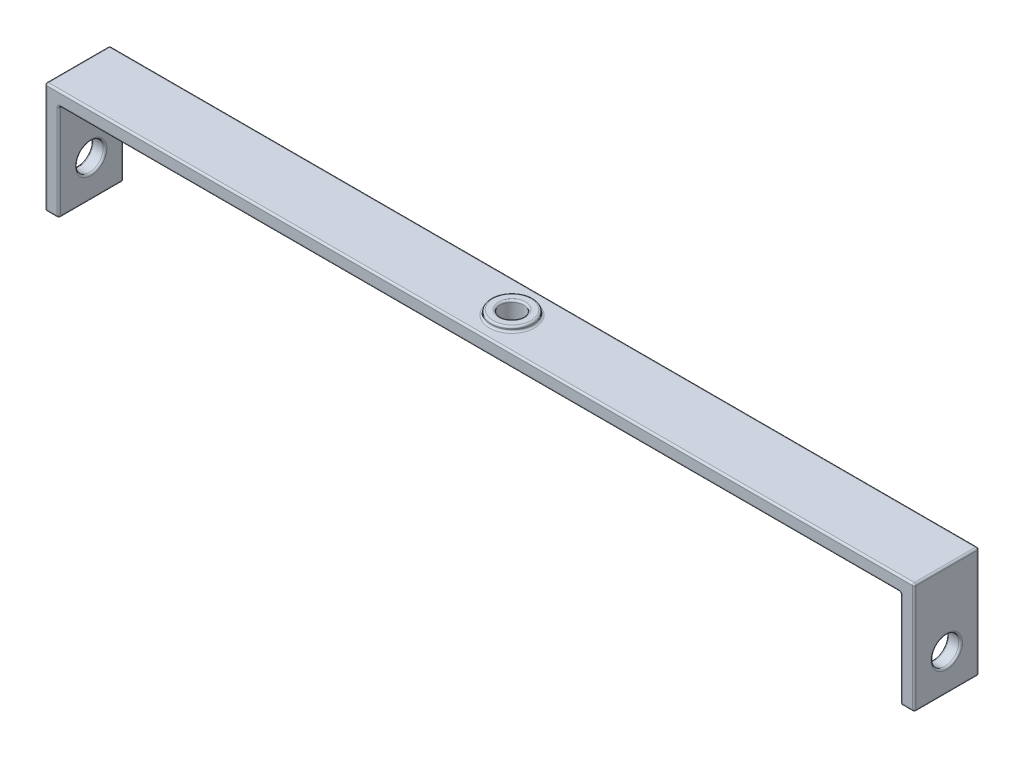
from build123d import *

# Parameters (mm, degrees)
BOSS_EXTRUDE1_DEPTH      = 3.5
BOSS_EXTRUDE1_DEPTH_BACK = 3.5
SKETCH2_R                = 1.25
CUT_EXTRUDE1_DEPTH       = 3.5
BOSS_EXTRUDE2_START      = 0.5
SKETCH3_R                = 2.25
SKETCH3_R_2              = 1.25
BOSS_EXTRUDE2_DEPTH      = 0.5
CUT_EXTRUDE2_DEPTH       = 49.633835958
CUT_EXTRUDE2_DEPTH_BACK  = 49.633835958
SKETCH4_R                = 1.5
FILLET1_R                = 0.2


with BuildPart() as part:
    # Sketch1 → Boss-Extrude1 (new, two sides: drawn at the far end of the back side and taken through both)
    with BuildSketch(Plane.XY.offset(-BOSS_EXTRUDE1_DEPTH_BACK)):
        Polygon((-47, -12), (-47, 0), (47, 0), (47, -12), (45.5, -12), (45.5, -1.5), (-45.5, -1.5), (-45.5, -12), align=None)
    extrude(amount=BOSS_EXTRUDE1_DEPTH + BOSS_EXTRUDE1_DEPTH_BACK)

    # Sketch2 → Cut-Extrude1 (cut)
    with BuildSketch(Plane(origin=(0, 0, 0), x_dir=(1, 0, 0), z_dir=(0, 1, 0))):
        Circle(SKETCH2_R)
    extrude(amount=-CUT_EXTRUDE1_DEPTH, mode=Mode.SUBTRACT)

    # Sketch3 → Boss-Extrude2 (add)
    with BuildSketch(Plane(origin=(0, 0, 0), x_dir=(1, 0, 0), z_dir=(0, 1, 0)).offset(BOSS_EXTRUDE2_START)):
        Circle(SKETCH3_R)
        Circle(SKETCH3_R_2, mode=Mode.SUBTRACT)
    extrude(amount=-BOSS_EXTRUDE2_DEPTH)

    # Sketch4 → Cut-Extrude2 (cut, two sides: drawn at the far end of the back side and taken through both)
    with BuildSketch(Plane(origin=(0, 0, 0), x_dir=(0, 0, -1), z_dir=(1, 0, 0)).offset(-CUT_EXTRUDE2_DEPTH_BACK)):
        with Locations((0, -8)):
            Circle(SKETCH4_R)
    extrude(amount=CUT_EXTRUDE2_DEPTH + CUT_EXTRUDE2_DEPTH_BACK, mode=Mode.SUBTRACT)

    # Fillet1
    fillet1_edges = [part.edges().sort_by_distance(p)[0] for p in [
        (47, -8, 1.5),
        (-47, -8, 1.5),
        (-45.5, -8, 1.5),
        (45.5, -8, 1.5),
        (-1.25, 0.5, 0),
        (-2.25, 0, 0),
        (-2.25, 0.5, 0),
        (-1.25, -1.5, 0),
        (-46.25, -12, 3.5),
        (-45.5, -6.75, 3.5),
        (0, -1.5, 3.5),
        (45.5, -6.75, 3.5),
        (46.25, -12, 3.5),
        (47, -6, 3.5),
        (-47, -6, 3.5),
        (-46.25, -12, -3.5),
        (-45.5, -6.75, -3.5),
        (0, -1.5, -3.5),
        (45.5, -6.75, -3.5),
        (46.25, -12, -3.5),
        (47, -6, -3.5),
        (0, 0, -3.5),
        (-47, -6, -3.5),
        (-45.5, -12, 0),
        (-45.5, -1.5, 0),
        (45.5, -1.5, 0),
        (45.5, -12, 0),
        (47, -12, 0),
        (47, 0, 0),
        (-47, 0, 0),
        (-47, -12, 0),
        (0, 0, 3.5),
    ]]
    fillet(fillet1_edges, radius=FILLET1_R)


solid = part.part
